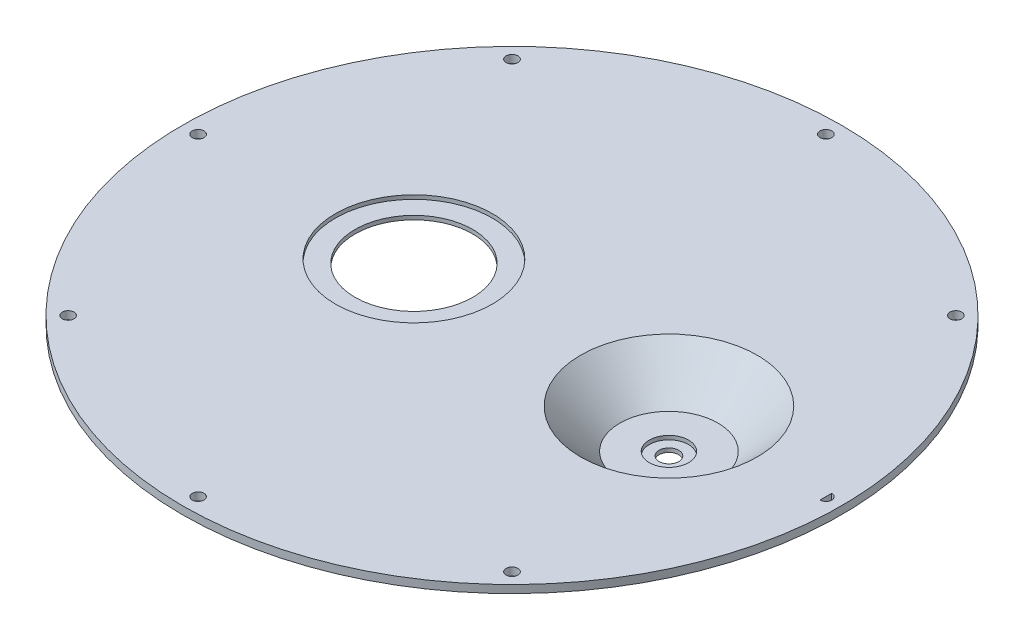
from build123d import *

# Parameters (mm, degrees)
SKETCH_1_R          = 84
EXTRUDE_1_DEPTH     = 2
SKETCH_2_R          = 1.5
CUT_EXTRUDE_1_DEPTH = 2
SKETCH_3_R          = 15
SKETCH_3_R_2        = 22.5
CUT_EXTRUDE_2_DEPTH = 2
SKETCH_4_R          = 20
CUT_EXTRUDE_3_DEPTH = 1


with BuildPart() as part:
    # 草图1 → 凸台-拉伸1 (new body)
    with BuildSketch(Plane(origin=(0, 0, 0), x_dir=(1, 0, 0), z_dir=(0, 1, 0))):
        with Locations(Location((0, 0, 0), (0, 0, 270))):
            Circle(SKETCH_1_R)
    extrude(amount=EXTRUDE_1_DEPTH)

    # 草图2 → 切除-拉伸1 (cut)
    with BuildSketch(Plane(origin=(0, 2, 0), x_dir=(1, 0, 0), z_dir=(0, 1, 0))):
        with Locations(Location((0, 80, 0), (0, 0, 270))):
            Circle(SKETCH_2_R)
        with Locations(Location((56.568542495, 56.568542495, 0), (0, 0, 270))):
            Circle(SKETCH_2_R)
        with Locations(Location((80, 0, 0), (0, 0, 270))):
            Circle(SKETCH_2_R)
        with Locations(Location((56.568542495, -56.568542495, 0), (0, 0, 270))):
            Circle(SKETCH_2_R)
        with Locations(Location((0, -80, 0), (0, 0, 270))):
            Circle(SKETCH_2_R)
        with Locations(Location((-56.568542495, -56.568542495, 0), (0, 0, 270))):
            Circle(SKETCH_2_R)
        with Locations(Location((-80, 0, 0), (0, 0, 270))):
            Circle(SKETCH_2_R)
        with Locations(Location((-56.568542495, 56.568542495, 0), (0, 0, 270))):
            Circle(SKETCH_2_R)
    extrude(amount=-CUT_EXTRUDE_1_DEPTH, mode=Mode.SUBTRACT)

    # 草图3 → 切除-拉伸2 (cut)
    with BuildSketch(Plane(origin=(0, 2, 0), x_dir=(1, 0, 0), z_dir=(0, 1, 0))):
        with Locations(Location((-25, 0, 0), (0, 0, 270))):
            Circle(SKETCH_3_R)
        with Locations(Location((40, 0, 0), (0, 0, 270))):
            Circle(SKETCH_3_R_2)
    extrude(amount=-CUT_EXTRUDE_2_DEPTH, mode=Mode.SUBTRACT)

    # 草图4 → 切除-拉伸3 (cut)
    with BuildSketch(Plane(origin=(0, 2, 0), x_dir=(1, 0, 0), z_dir=(0, 1, 0))):
        with Locations(Location((-25, 0, 0), (0, 0, 270))):
            Circle(SKETCH_4_R)
    extrude(amount=-CUT_EXTRUDE_3_DEPTH, mode=Mode.SUBTRACT)

    # 草图6 → 旋转1 (revolve)
    with BuildSketch(Plane.XY):
        Polygon((0, 2), (17.5, 2), (27.498489886, -7.998489886), (34.998489886, -7.998489886), (34.998489886, -8.998489886), (37.498489886, -8.998489886), (37.498489886, -9.998489886), (26.088489886, -9.998489886), (16.09, 0), (0, 0), align=None)
    revolve(axis=Axis((40, 0, 0), (0, -1, 0)))


solid = part.part
